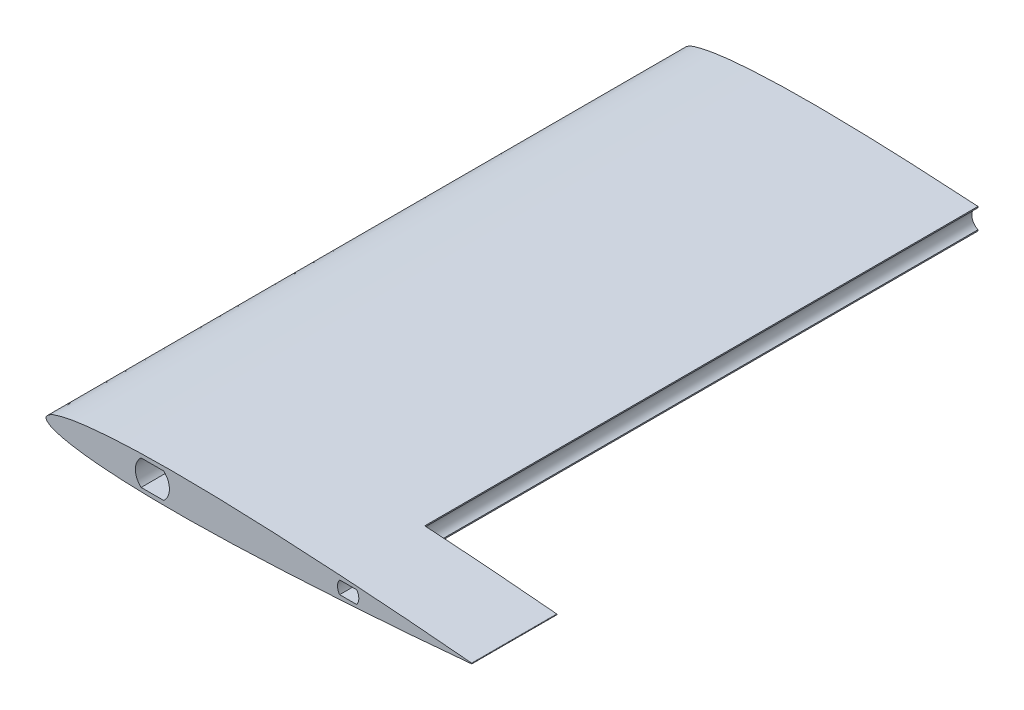
from build123d import *

# Parameters (mm, degrees)
CORPOFOAM_DEPTH          = 130
FOAMLATERALE_DEPTH       = 20
SCHIZZO2_R               = 3
FOROLONGHERONE_DEPTH     = 181.368553558
TAGLIO_ESTRUSIONE1_DEPTH = 15
SCHIZZO6_W               = 3
SCHIZZO6_H               = 5.01489576
SMUSSOPOSTERIORE_DEPTH   = 130
FOROPERNO_DEPTH          = 181.368553558


with BuildPart() as part:
    # Schizzo1 → CorpoFoam (new body)
    with BuildSketch(Plane.XY):
        with BuildLine():
            ThreePointArc((70, -2.443), (67.557, 0), (70, 2.443))
            add(Edge.make_bspline(
                [(70, 2.443), (66.667669045, 2.659279734), (60.003104625, 3.061747723), (50.003008601, 3.552139212), (40.002598558, 3.902946494), (31.666961486, 4.025260151), (24.9991546, 3.976933791), (19.997775587, 3.844976398), (14.993363131, 3.592486959), (10.827184065, 3.237651579), (7.489054388, 2.814021367), (4.99359465, 2.403673059), (2.84962634, 1.867925494), (1.165413503, 1.320987252), (-0.664613784, 0), (1.165413503, -1.320987252), (2.84962634, -1.867925494), (4.99359465, -2.403673059), (7.489054388, -2.814021367), (10.827184065, -3.237651579), (14.993363131, -3.592486959), (19.997775587, -3.844976398), (24.9991546, -3.976933791), (31.666961486, -4.025260151), (40.002598558, -3.902946494), (50.003008601, -3.552139212), (60.003104625, -3.061747723), (66.667669045, -2.659279734), (70, -2.443)],
                knots=[0.149112224, 0.149112224, 0.149112224, 0.149112224, 0.198750974, 0.248359097, 0.29793737, 0.347491327, 0.37226694, 0.397050924, 0.421859475, 0.446731346, 0.459220451, 0.471790602, 0.484560454, 0.491195112, 0.5, 0.508804888, 0.515439546, 0.528209398, 0.540779549, 0.553268654, 0.578140525, 0.602949076, 0.62773306, 0.652508673, 0.70206263, 0.751640903, 0.801249026, 0.850887776, 0.850887776, 0.850887776, 0.850887776], degree=3))
        make_face()
    extrude(amount=CORPOFOAM_DEPTH)

    # Schizzo7 → FoamLaterale (add)
    with BuildSketch(Plane.XY.offset(130)):
        with BuildLine():
            ThreePointArc((100, 0.084), (100.084, 0), (100, -0.084))
            add(Edge.make_bspline(
                [(100, 0.084), (98.333488815, 0.23674648), (95.001194725, 0.542172689), (88.335559621, 1.11089898), (80.003293356, 1.763610995), (70.002998933, 2.457861693), (60.003104625, 3.061747723), (50.003008601, 3.552139212), (40.002598558, 3.902946494), (31.666961486, 4.025260151), (24.9991546, 3.976933791), (19.997775587, 3.844976398), (14.993363131, 3.592486959), (10.827184065, 3.237651579), (7.489054388, 2.814021367), (4.99359465, 2.403673059), (2.84962634, 1.867925494), (1.165413503, 1.320987252), (-0.664613784, 0), (1.165413503, -1.320987252), (2.84962634, -1.867925494), (4.99359465, -2.403673059), (7.489054388, -2.814021367), (10.827184065, -3.237651579), (14.993363131, -3.592486959), (19.997775587, -3.844976398), (24.9991546, -3.976933791), (31.666961486, -4.025260151), (40.002598558, -3.902946494), (50.003008601, -3.552139212), (60.003104625, -3.061747723), (70.002998933, -2.457861693), (80.003293356, -1.763610995), (88.335559621, -1.11089898), (95.001194725, -0.542172689), (98.333488815, -0.23674648), (100, -0.084)],
                knots=[0, 0, 0, 0, 0.024876293, 0.049741715, 0.099443402, 0.149112224, 0.198750974, 0.248359097, 0.29793737, 0.347491327, 0.37226694, 0.397050924, 0.421859475, 0.446731346, 0.459220451, 0.471790602, 0.484560454, 0.491195112, 0.5, 0.508804888, 0.515439546, 0.528209398, 0.540779549, 0.553268654, 0.578140525, 0.602949076, 0.62773306, 0.652508673, 0.70206263, 0.751640903, 0.801249026, 0.850887776, 0.900556598, 0.950258285, 0.975123707, 1, 1, 1, 1], degree=3))
        make_face()
    extrude(amount=FOAMLATERALE_DEPTH)

    # Schizzo2 → ForoLongherone (cut, through all)
    with BuildSketch(Plane.XY.offset(150)):
        with Locations((25, 0)):
            Circle(SCHIZZO2_R)
    extrude(amount=-FOROLONGHERONE_DEPTH, mode=Mode.SUBTRACT)

    # Schizzo5 → Taglio-Estrusione1 (cut)
    with BuildSketch(Plane(origin=(0, 0, 150), x_dir=(-1, 0, 0), z_dir=(0, 0, -1))):
        with BuildLine():
            Line((-27.645751311, 3), (-22.354248689, 3))
            ThreePointArc((-22.354248689, 3), (-21, 0), (-22.354248689, -3))
            Line((-22.354248689, -3), (-27.645751311, -3))
            ThreePointArc((-27.645751311, -3), (-29, 0), (-27.645751311, 3))
        make_face()
    extrude(amount=TAGLIO_ESTRUSIONE1_DEPTH, mode=Mode.SUBTRACT)

    # Schizzo6 → SmussoPosteriore (cut)
    with BuildSketch(Plane(origin=(0, 0, 0), x_dir=(-1, 0, 0), z_dir=(0, 0, -1))):
        with Locations((-70.5, 0)):
            Rectangle(SCHIZZO6_W, SCHIZZO6_H)
    extrude(amount=-SMUSSOPOSTERIORE_DEPTH, mode=Mode.SUBTRACT)

    # Schizzo8 → ForoPerno (cut, through all)
    with BuildSketch(Plane.XY.offset(150)):
        with BuildLine():
            Line((69, 1.5), (73, 1.5))
            ThreePointArc((73, 1.5), (73.5, 0), (73, -1.5))
            Line((73, -1.5), (69, -1.5))
            ThreePointArc((69, -1.5), (68.5, 0), (69, 1.5))
        make_face()
    extrude(amount=-FOROPERNO_DEPTH, mode=Mode.SUBTRACT)


solid = part.part
